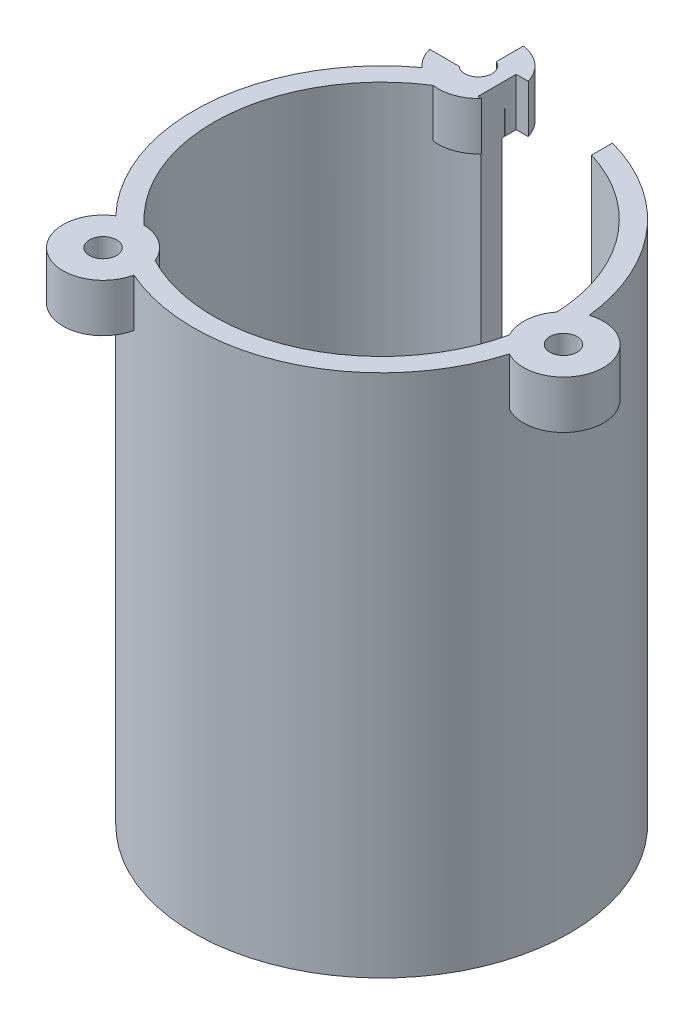
from build123d import *

# Parameters (mm, degrees)
WHEEL_SUPPORT_RAILS_1_PROFILE_R       = 1.7
WHEEL_SUPPORT_RAILS_1_EXTRUSION_DEPTH = 3
WHEEL_SUPPORT_RAILS_2_EXTRUSION_DEPTH = 3
WHEEL_SUPPORT_RAILS_3_EXTRUSION_DEPTH = 0.1
WHEEL_SUPPORT_RAILS_4_EXTRUSION_DEPTH = 0.1
PIVOT_BACKING_5_EXTRUSION_DEPTH       = 59.3


with BuildPart() as part:
    # Wheel support rails 1 profile → Wheel support rails 1 extrusion (new body)
    with BuildSketch(Plane(origin=(0, -200, 0), x_dir=(1, 0, 0), z_dir=(0, 1, 0))):
        with BuildLine():
            Line((-19.3635199, 72.551817663), (-19.796031534, 72.551817663))
            Line((-19.796031534, 72.551817663), (-19.796031534, 77.344882879))
            Line((-19.796031534, 77.344882879), (-18.287181296, 77.344882879))
            ThreePointArc((-18.287181296, 77.344882879), (-19.831302101, 79.707937327), (-22.409182889, 80.858096458))
            Line((-22.409182889, 80.858096458), (-22.409182889, 77.466920099))
            ThreePointArc((-22.409182889, 77.466920099), (-21.643496924, 74.985063993), (-24.218406931, 74.644882879))
            Line((-24.218406931, 74.644882879), (-27.913875328, 74.644882879))
            ThreePointArc((-27.913875328, 74.644882879), (-27.347266001, 73.305528815), (-26.419206918, 72.185876289))
            ThreePointArc((-26.419206918, 72.185876289), (-35.919758288, 55.293042834), (-29.496951386, 37.007096044))
            ThreePointArc((-29.496951386, 37.007096044), (-29.716475974, 28.670321551), (-21.957552332, 31.727951993))
            ThreePointArc((-21.957552332, 31.727951993), (-2.577653733, 31.946649884), (10.047037269, 46.651937219))
            ThreePointArc((10.047037269, 46.651937219), (17.37665806, 50.630210597), (10.849210599, 55.820820355))
            ThreePointArc((10.849210599, 55.820820355), (5.348356993, 68.520951403), (-6.346539744, 75.922445127))
            Line((-6.346539744, 75.922445127), (-6.346539744, 73.320286475))
            ThreePointArc((-6.346539744, 73.320286475), (4.101805551, 66.093036958), (8.470715341, 54.163507116))
            ThreePointArc((8.470715341, 54.163507116), (7.414711079, 51.501768024), (7.992466121, 48.697093513))
            ThreePointArc((7.992466121, 48.697093513), (-3.634199387, 34.212419351), (-22.203580069, 34.616445929))
            ThreePointArc((-22.203580069, 34.616445929), (-23.98071161, 36.861841994), (-26.698508507, 37.763828705))
            ThreePointArc((-26.698508507, 37.763828705), (-33.429271543, 55.075153477), (-23.794683922, 70.954695591))
            ThreePointArc((-23.794683922, 70.954695591), (-21.379253869, 71.198784638), (-19.3635199, 72.551817663))
        make_face()
        with Locations((12.395684569, 51.06598931)):
            Circle(WHEEL_SUPPORT_RAILS_1_PROFILE_R, mode=Mode.SUBTRACT)
        with Locations((-26.848593792, 32.766081772)):
            Circle(WHEEL_SUPPORT_RAILS_1_PROFILE_R, mode=Mode.SUBTRACT)
    extrude(amount=WHEEL_SUPPORT_RAILS_1_EXTRUSION_DEPTH)

    # Wheel support rails 2 profile → Wheel support rails 2 extrusion (add)
    # profile 1 of 2: a face of its own
    with BuildSketch(Plane(origin=(0, -197, 0), x_dir=(1, 0, 0), z_dir=(0, 1, 0))):
        with BuildLine():
            Line((-19.3635199, 72.551817663), (-19.796031533, 72.551817663))
            Line((-19.796031533, 72.551817663), (-19.796031533, 75.86552534))
            Line((-19.796031533, 75.86552534), (-21.424639427, 73.044693722))
            Line((-21.424639427, 73.044693722), (-24.724639427, 73.044693722))
            Line((-24.724639427, 73.044693722), (-25.648509068, 74.644882879))
            Line((-25.648509068, 74.644882879), (-27.913875328, 74.644882879))
            ThreePointArc((-27.913875328, 74.644882879), (-27.347266001, 73.305528815), (-26.419206918, 72.185876289))
            ThreePointArc((-26.419206918, 72.185876289), (-35.919758288, 55.293042834), (-29.496951386, 37.007096044))
            ThreePointArc((-29.496951386, 37.007096044), (-29.716475974, 28.670321551), (-21.957552332, 31.727951993))
            ThreePointArc((-21.957552332, 31.727951993), (-2.577653733, 31.946649884), (10.047037269, 46.651937219))
            ThreePointArc((10.047037269, 46.651937219), (17.37665806, 50.630210597), (10.849210599, 55.820820355))
            ThreePointArc((10.849210599, 55.820820355), (5.348356993, 68.520951403), (-6.346539744, 75.922445127))
            Line((-6.346539744, 75.922445127), (-6.346539744, 73.320286475))
            ThreePointArc((-6.346539744, 73.320286475), (4.101805551, 66.093036958), (8.470715341, 54.163507116))
            ThreePointArc((8.470715341, 54.163507116), (7.414711079, 51.501768024), (7.992466121, 48.697093513))
            ThreePointArc((7.992466121, 48.697093513), (-3.634199387, 34.212419351), (-22.203580069, 34.616445929))
            ThreePointArc((-22.203580069, 34.616445929), (-23.98071161, 36.861841994), (-26.698508507, 37.763828705))
            ThreePointArc((-26.698508507, 37.763828705), (-33.429271543, 55.075153477), (-23.794683922, 70.954695591))
            ThreePointArc((-23.794683922, 70.954695591), (-21.379253869, 71.198784638), (-19.3635199, 72.551817663))
        make_face()
        Polygon((9.095684569, 51.06598931), (10.745684569, 53.923873143), (14.045684569, 53.923873143), (15.695684569, 51.06598931), (14.045684569, 48.208105478), (10.745684569, 48.208105478), align=None, mode=Mode.SUBTRACT)
        Polygon((-30.148593792, 32.766081772), (-28.498593792, 35.623965604), (-25.198593792, 35.623965604), (-23.548593792, 32.766081772), (-25.198593792, 29.908197939), (-28.498593792, 29.908197939), align=None, mode=Mode.SUBTRACT)
    # profile 2 of 2: a face of its own
    with BuildSketch(Plane(origin=(0, -197, 0), x_dir=(1, 0, 0), z_dir=(0, 1, 0))):
        with BuildLine():
            Line((-22.409182889, 78.760461387), (-21.424639427, 78.760461387))
            Line((-21.424639427, 78.760461387), (-19.796031533, 75.939629769))
            Line((-19.796031533, 75.939629769), (-19.796031533, 77.344882879))
            Line((-19.796031533, 77.344882879), (-18.287181296, 77.344882879))
            ThreePointArc((-18.287181296, 77.344882879), (-19.831302101, 79.707937327), (-22.409182889, 80.858096458))
            Line((-22.409182889, 80.858096458), (-22.409182889, 78.760461387))
        make_face()
    extrude(amount=WHEEL_SUPPORT_RAILS_2_EXTRUSION_DEPTH)

    # Wheel support rails 3 profile → Wheel support rails 3 extrusion (add)
    with BuildSketch(Plane(origin=(0, -194, 0), x_dir=(1, 0, 0), z_dir=(0, 1, 0))):
        with BuildLine():
            Line((9.095684569, 51.06598931), (10.745684569, 53.923873143))
            Line((10.745684569, 53.923873143), (10.981005967, 53.923873143))
            ThreePointArc((10.981005967, 53.923873143), (5.95177331, 67.785965934), (-6.346539744, 75.922445127))
            Line((-6.346539744, 75.922445127), (-6.346539744, 73.320286475))
            ThreePointArc((-6.346539744, 73.320286475), (-11.915808048, 32.253267736), (-19.796031533, 72.940106583))
            Line((-19.796031533, 72.940106583), (-19.796031533, 75.586589097))
            ThreePointArc((-19.796031533, 75.586589097), (-19.895657477, 75.553849531), (-19.99513633, 75.520665715))
            Line((-19.99513633, 75.520665715), (-21.424639427, 73.044693721))
            Line((-21.424639427, 73.044693721), (-24.724639427, 73.044693721))
            Line((-24.724639427, 73.044693721), (-24.842300126, 73.24848803))
            ThreePointArc((-24.842300126, 73.24848803), (-35.923839859, 55.245842318), (-28.057599985, 35.623965605))
            Line((-28.057599985, 35.623965605), (-25.198593791, 35.623965605))
            Line((-25.198593791, 35.623965605), (-23.548593792, 32.766081772))
            Line((-23.548593792, 32.766081772), (-23.666254491, 32.562287463))
            ThreePointArc((-23.666254491, 32.562287463), (-2.534736101, 31.966715397), (10.525187666, 48.590017317))
            Line((10.525187666, 48.590017317), (9.095684569, 51.06598931))
        make_face()
    extrude(amount=WHEEL_SUPPORT_RAILS_3_EXTRUSION_DEPTH)

    # Wheel support rails 4 profile → Wheel support rails 4 extrusion (add)
    with BuildSketch(Plane(origin=(0, -193.9, 0), x_dir=(1, 0, 0), z_dir=(0, 1, 0))):
        with BuildLine():
            Line((-6.346539744, 75.922445127), (-6.346539744, 73.320286475))
            ThreePointArc((-6.346539744, 73.320286475), (-11.915808048, 32.253267736), (-19.796031533, 72.940106583))
            Line((-19.796031533, 72.940106583), (-19.796031533, 75.586589097))
            ThreePointArc((-19.796031533, 75.586589097), (-20.77224205, 75.244243169), (-21.732439848, 74.859265381))
            ThreePointArc((-21.732439848, 74.859265381), (-22.356188381, 74.361854317), (-23.138165192, 74.203764887))
            ThreePointArc((-23.138165192, 74.203764887), (-35.919758287, 55.293042834), (-26.616158734, 34.450116791))
            ThreePointArc((-26.616158734, 34.450116791), (-25.873513849, 34.158640248), (-25.345615983, 33.560473178))
            ThreePointArc((-25.345615983, 33.560473178), (-2.577653732, 31.946649884), (10.821049933, 50.425266465))
            ThreePointArc((10.821049933, 50.425266465), (10.702153582, 51.214154072), (10.956232526, 51.97041057))
            ThreePointArc((10.956232526, 51.97041057), (6.540238452, 67.006043687), (-6.346539744, 75.922445127))
        make_face()
    extrude(amount=WHEEL_SUPPORT_RAILS_4_EXTRUSION_DEPTH)

    # Pivot backing 5 profile → Pivot backing 5 extrusion (add)
    with BuildSketch(Plane(origin=(0, -193.8, 0), x_dir=(1, 0, 0), z_dir=(0, 1, 0))):
        with BuildLine():
            Line((-6.346539744, 75.922445127), (-6.346539744, 73.320286475))
            ThreePointArc((-6.346539744, 73.320286475), (-11.915808048, 32.253267736), (-19.796031533, 72.940106583))
            Line((-19.796031533, 72.940106583), (-19.796031533, 75.586589097))
            ThreePointArc((-19.796031533, 75.586589097), (-11.922531942, 29.752206559), (-6.346539744, 75.922445127))
        make_face()
    extrude(amount=PIVOT_BACKING_5_EXTRUSION_DEPTH)


with BuildPart() as body_2:
    # Mirror1: mirrored copy
    add(part.part.mirror(Plane(origin=(0, 0, 0), x_dir=(0, 0, 1), z_dir=(0, -1, 0))))


solid = body_2.part
